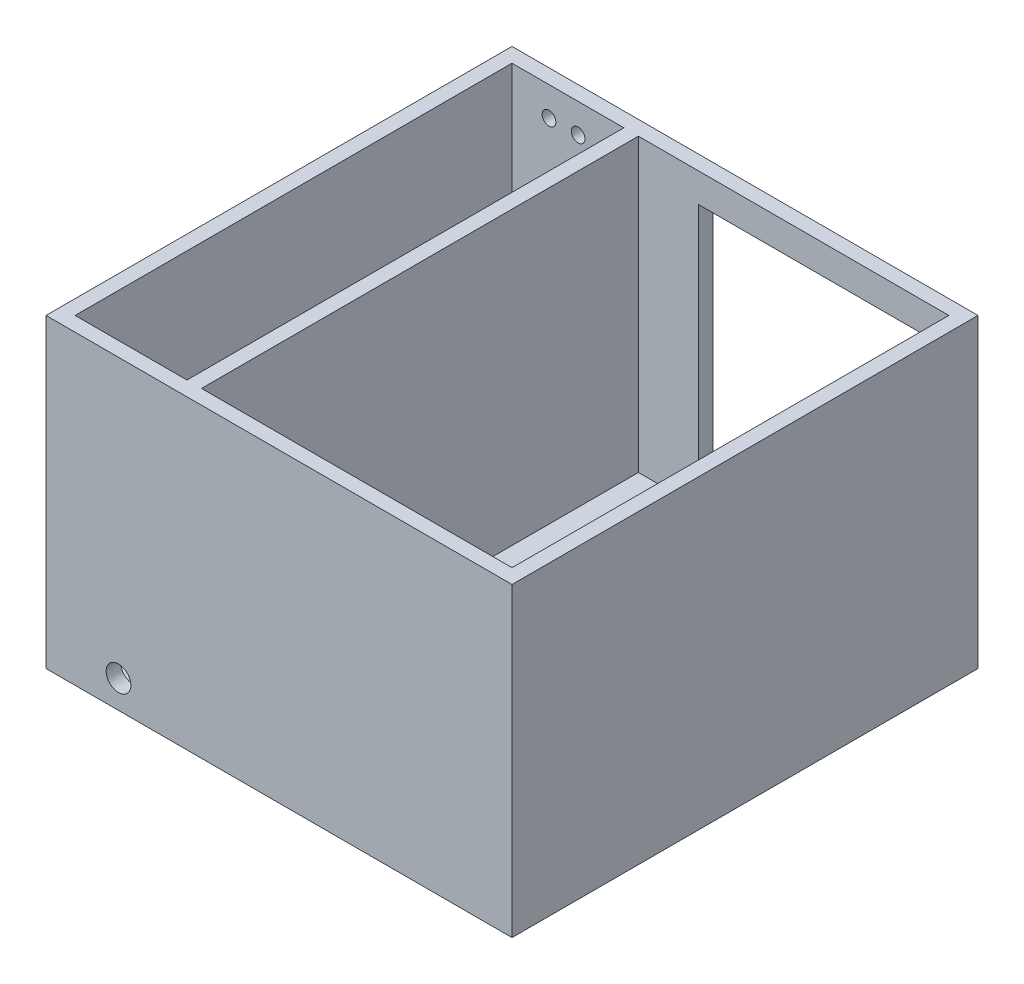
from build123d import *

# Parameters (mm, degrees)
SKETCH1_W           = 203.2
SKETCH1_H           = 127
BOSS_EXTRUDE1_DEPTH = 6.35
SKETCH2_W           = 101.6
SKETCH2_H           = 101.6
SKETCH2_W_2         = 22.606
SKETCH2_H_2         = 3.302
CUT_EXTRUDE1_DEPTH  = 6.35
SKETCH3_W           = 203.2
SKETCH3_H           = 203.2
BOSS_EXTRUDE2_DEPTH = 6.35
SKETCH4_W           = 196.85
SKETCH4_H           = 127
BOSS_EXTRUDE3_DEPTH = 6.35
SKETCH5_W           = 190.5
SKETCH5_H           = 127
BOSS_EXTRUDE4_DEPTH = 6.35
SKETCH7_W           = 6.35
SKETCH7_H           = 190.5
BOSS_EXTRUDE5_DEPTH = 127
SKETCH8_R           = 5.3975
CUT_EXTRUDE2_DEPTH  = 6.35
SKETCH9_R           = 2.9972
CUT_EXTRUDE3_DEPTH  = 6.35


with BuildPart() as part:
    # Sketch1 → Boss-Extrude1 (new body)
    with BuildSketch(Plane.XY):
        with Locations((-101.6, 63.5)):
            Rectangle(SKETCH1_W, SKETCH1_H)
    extrude(amount=BOSS_EXTRUDE1_DEPTH)

    # Sketch2 → Cut-Extrude1 (cut)
    with BuildSketch(Plane.XY.offset(6.35)):
        with Locations((-64.77, 63.5)):
            Rectangle(SKETCH2_W, SKETCH2_H)
        with Locations((-159.385, 14.351)):
            Rectangle(SKETCH2_W_2, SKETCH2_H_2)
    extrude(amount=-CUT_EXTRUDE1_DEPTH, mode=Mode.SUBTRACT)

    # Sketch3 → Boss-Extrude2 (add)
    with BuildSketch(Plane.XZ):
        with Locations((-101.6, 101.6)):
            Rectangle(SKETCH3_W, SKETCH3_H)
    extrude(amount=BOSS_EXTRUDE2_DEPTH)

    # Sketch4 → Boss-Extrude3 (add)
    with BuildSketch(Plane.ZY.offset(203.2)):
        with Locations((104.775, 63.5)):
            Rectangle(SKETCH4_W, SKETCH4_H)
    boss_extrude3 = extrude(amount=-BOSS_EXTRUDE3_DEPTH)

    # Mirror1: Boss-Extrude3 across plane
    add(boss_extrude3.mirror(Plane(origin=(-101.6, 0, 0), x_dir=(0, 0, 1), z_dir=(1, 0, 0))))

    # Sketch5 → Boss-Extrude4 (add)
    with BuildSketch(Plane.XY.offset(203.2)):
        with Locations((-101.6, 63.5)):
            Rectangle(SKETCH5_W, SKETCH5_H)
    extrude(amount=-BOSS_EXTRUDE4_DEPTH)

    # Sketch7 → Boss-Extrude5 (add)
    with BuildSketch(Plane(origin=(0, 0, 0), x_dir=(1, 0, 0), z_dir=(0, 1, 0))):
        with Locations((-144.907, -101.6)):
            Rectangle(SKETCH7_W, SKETCH7_H)
    extrude(amount=BOSS_EXTRUDE5_DEPTH)

    # Sketch8 → Cut-Extrude2 (cut)
    with BuildSketch(Plane.XY.offset(203.2)):
        with Locations((-171.577, 5.7785)):
            Circle(SKETCH8_R)
    extrude(amount=-CUT_EXTRUDE2_DEPTH, mode=Mode.SUBTRACT)

    # Sketch9 → Cut-Extrude3 (cut)
    with BuildSketch(Plane(origin=(0, 0, 0), x_dir=(-1, 0, 0), z_dir=(0, 0, -1))):
        with Locations((168.021, 114.3)):
            Circle(SKETCH9_R)
        with Locations((180.721, 114.3)):
            Circle(SKETCH9_R)
    extrude(amount=-CUT_EXTRUDE3_DEPTH, mode=Mode.SUBTRACT)


solid = part.part
